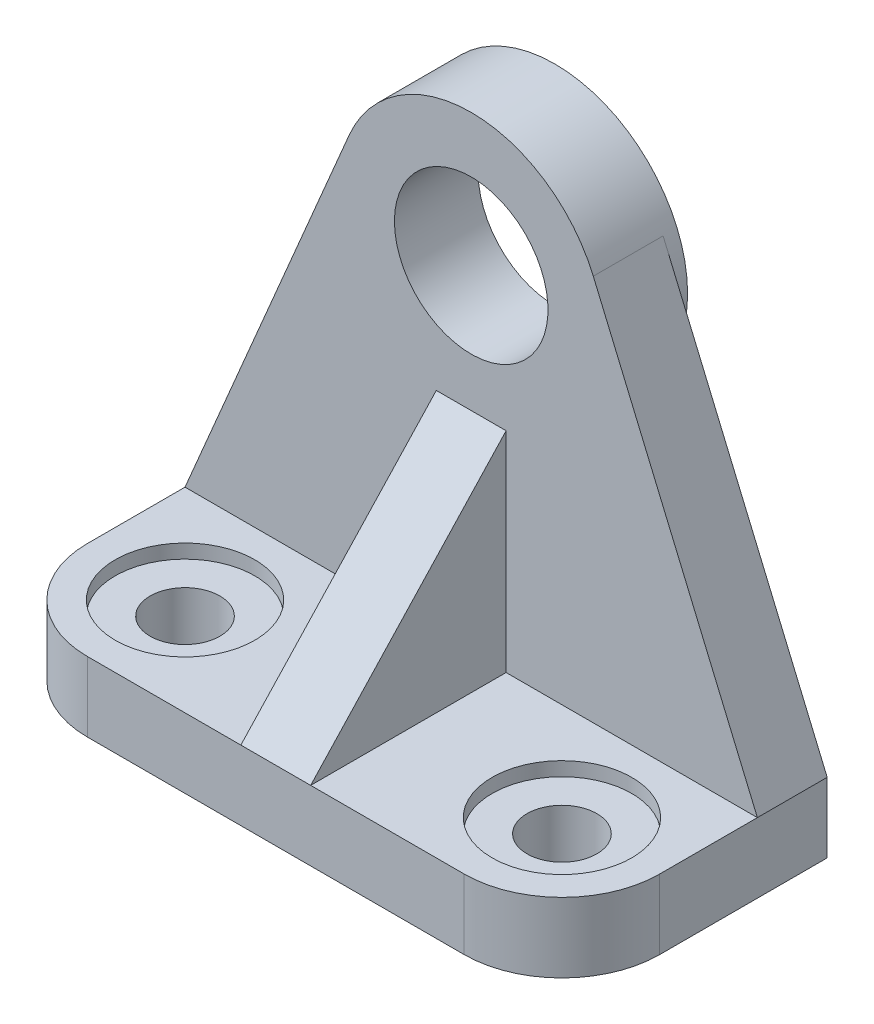
from build123d import *

# Parameters (mm, degrees)
SKETCH1_W           = 82
SKETCH1_H           = 38
BOSS_EXTRUDE1_DEPTH = 10
BOSS_EXTRUDE3_DEPTH = 10
BOSS_EXTRUDE4_START = 2
BOSS_EXTRUDE4_DEPTH = 12
SKETCH5_R           = 11
CUT_EXTRUDE2_DEPTH  = 96.968744912
FILLET1_R           = 14
SKETCH6_R           = 10
CUT_EXTRUDE3_DEPTH  = 2
SKETCH7_R           = 5
CUT_EXTRUDE4_DEPTH  = 83.963847548
RIB1_REACH          = 91.727
SKETCH8_WALL_W      = 222.491298724
SKETCH8_WALL_H      = 10


with BuildPart() as part:
    # Sketch1 → Boss-Extrude1 (new body)
    with BuildSketch(Plane(origin=(0, 0, 0), x_dir=(1, 0, 0), z_dir=(0, 1, 0))):
        Rectangle(SKETCH1_W, SKETCH1_H)
    extrude(amount=BOSS_EXTRUDE1_DEPTH)

    # Sketch4 → Boss-Extrude3 (add)
    with BuildSketch(Plane(origin=(0, 0, -19), x_dir=(-1, 0, 0), z_dir=(0, 0, -1))):
        with BuildLine():
            Line((-41, 10), (41, 10))
            Line((41, 10), (17.491366878, 65.419709208))
            ThreePointArc((17.491366878, 65.419709208), (0, 39), (-17.491366878, 65.419709208))
            Line((-17.491366878, 65.419709208), (-41, 10))
        make_face()
    extrude(amount=-BOSS_EXTRUDE3_DEPTH)

    # Sketch4<3> → Boss-Extrude4 (add)
    with BuildSketch(Plane(origin=(0, 0, -19), x_dir=(-1, 0, 0), z_dir=(0, 0, -1)).offset(BOSS_EXTRUDE4_START)):
        with BuildLine():
            ThreePointArc((17.491366878, 65.419709208), (0, 77), (-17.491366878, 65.419709208))
            ThreePointArc((-17.491366878, 65.419709208), (-3.785764739, 39.380977863), (19, 58))
            ThreePointArc((19, 58), (18.619022137, 61.785764739), (17.491366878, 65.419709208))
        make_face()
    extrude(amount=-BOSS_EXTRUDE4_DEPTH)

    # Sketch5 → Cut-Extrude2 (cut, through all)
    with BuildSketch(Plane(origin=(0, 0, -21), x_dir=(-1, 0, 0), z_dir=(0, 0, -1))):
        with Locations((0, 58)):
            Circle(SKETCH5_R)
    extrude(amount=-CUT_EXTRUDE2_DEPTH, mode=Mode.SUBTRACT)

    # Fillet1
    fillet1_edges = [part.edges().sort_by_distance(p)[0] for p in [
        (41, 5, 19),
        (-41, 5, 19),
    ]]
    fillet(fillet1_edges, radius=FILLET1_R)

    # Sketch6 → Cut-Extrude3 (cut)
    with BuildSketch(Plane(origin=(0, 10, 0), x_dir=(1, 0, 0), z_dir=(0, 1, 0))):
        with Locations((-27, -5)):
            Circle(SKETCH6_R)
    cut_extrude3 = extrude(amount=-CUT_EXTRUDE3_DEPTH, mode=Mode.SUBTRACT)

    # Sketch7 → Cut-Extrude4 (cut, through all)
    with BuildSketch(Plane(origin=(0, 8, 0), x_dir=(1, 0, 0), z_dir=(0, 1, 0))):
        with Locations((-27, -5)):
            Circle(SKETCH7_R)
    cut_extrude4 = extrude(amount=-CUT_EXTRUDE4_DEPTH, mode=Mode.SUBTRACT)

    # Sketch8 wall → Rib1 (add, up to next)
    with BuildSketch(Plane(origin=(0, 25, 5), x_dir=(0, 0.731055268243, -0.68231825036), z_dir=(0, 0.68231825036, 0.731055268243)), mode=Mode.PRIVATE) as rib1_sk1:
        Rectangle(SKETCH8_WALL_W, SKETCH8_WALL_H)
    rib1_tool1 = extrude(rib1_sk1.sketch, amount=-RIB1_REACH, mode=Mode.PRIVATE) - part.part
    add(rib1_tool1.solids().sort_by_distance((0, 25, 5))[0])

    # Mirror1: Cut-Extrude3 across plane
    add(cut_extrude3.mirror(Plane(origin=(0, 0, 0), x_dir=(0, 0, 1), z_dir=(1, 0, 0))), mode=Mode.SUBTRACT)

    # Mirror2: Cut-Extrude4 across plane
    add(cut_extrude4.mirror(Plane(origin=(0, 0, 0), x_dir=(0, 0, 1), z_dir=(1, 0, 0))), mode=Mode.SUBTRACT)


solid = part.part
